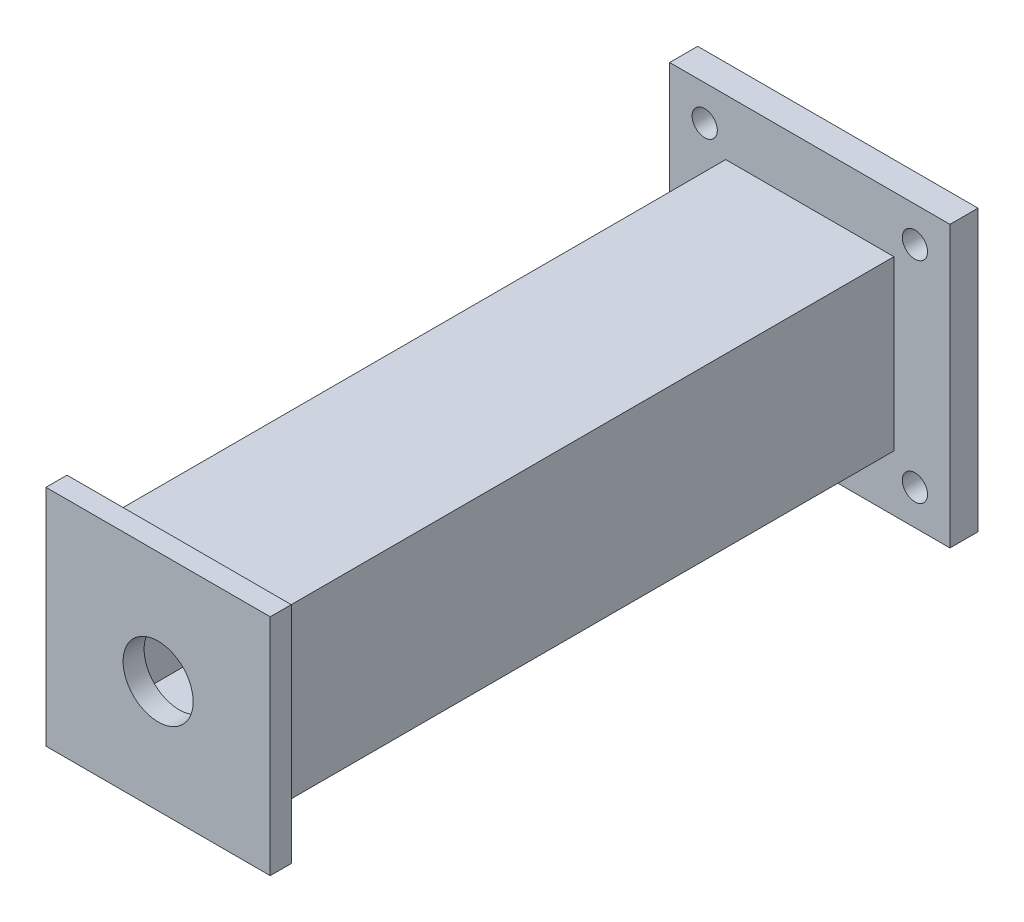
from build123d import *

# Parameters (mm, degrees)
SKETCH_8_W      = 120
SKETCH_8_H      = 120
SKETCH_8_W_2    = 100
SKETCH_8_H_2    = 100
EXTRUDE_1_DEPTH = 225
SKETCH_9_W      = 160
SKETCH_9_H      = 160
SKETCH_9_R      = 25
EXTRUDE_2_DEPTH = 15
SKETCH_10_W     = 200
SKETCH_10_H     = 200
SKETCH_10_R     = 9
EXTRUDE_3_DEPTH = 20


with BuildPart() as part:
    # 草图8 → 凸台-拉伸1 (new, symmetric)
    with BuildSketch(Plane.XY):
        Rectangle(SKETCH_8_W, SKETCH_8_H)
        Rectangle(SKETCH_8_W_2, SKETCH_8_H_2, mode=Mode.SUBTRACT)
    extrude(amount=EXTRUDE_1_DEPTH, both=True)

    # 草图9 → 凸台-拉伸2 (add)
    with BuildSketch(Plane.XY.offset(225)):
        Rectangle(SKETCH_9_W, SKETCH_9_H)
        Circle(SKETCH_9_R, mode=Mode.SUBTRACT)
    extrude(amount=EXTRUDE_2_DEPTH)

    # 草图10 → 凸台-拉伸3 (add)
    with BuildSketch(Plane(origin=(0, 0, -225), x_dir=(-1, 0, 0), z_dir=(0, 0, -1))):
        Rectangle(SKETCH_10_W, SKETCH_10_H)
        with Locations((75, 75)):
            Circle(SKETCH_10_R, mode=Mode.SUBTRACT)
        with Locations((-75, 75)):
            Circle(SKETCH_10_R, mode=Mode.SUBTRACT)
        with Locations((75, -75)):
            Circle(SKETCH_10_R, mode=Mode.SUBTRACT)
        with Locations((-75, -75)):
            Circle(SKETCH_10_R, mode=Mode.SUBTRACT)
    extrude(amount=EXTRUDE_3_DEPTH)


solid = part.part
